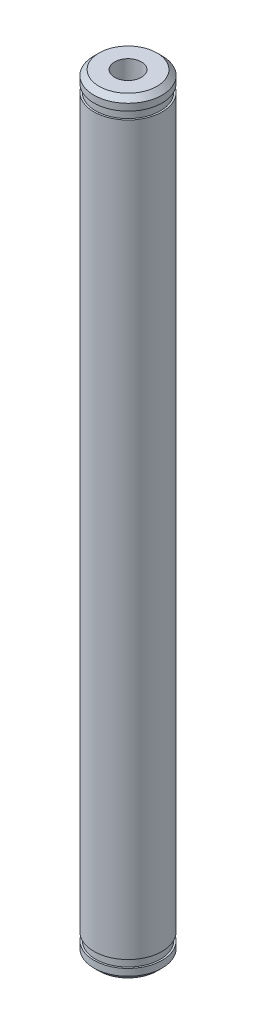
from build123d import *

# Parameters (mm, degrees)
SKETCH1_R                        = 4
BOSS_EXTRUDE1_DEPTH              = 90
CHAMFER1_SIZE                    = 0.6
CUT_EXTRUDE1_START               = -1.4
SKETCH2_R                        = 4
SKETCH2_R_2                      = 3.8
CUT_EXTRUDE1_DEPTH               = 0.9
TAP_DRILL_FOR_M3_HELICOIL1_D     = 3.15
TAP_DRILL_FOR_M3_HELICOIL1_DEPTH = 6


with BuildPart() as part:
    # Sketch1 → Boss-Extrude1 (new body)
    with BuildSketch(Plane(origin=(0, 0, 0), x_dir=(1, 0, 0), z_dir=(0, 1, 0))):
        with Locations(Location((0, 0, 0), (0, 0, 90))):
            Circle(SKETCH1_R)
    extrude(amount=BOSS_EXTRUDE1_DEPTH)

    # Chamfer1
    chamfer1_edges = [part.edges().sort_by_distance(p)[0] for p in [
        (0, 0, 4),
        (0, 90, 4),
    ]]
    chamfer(chamfer1_edges, length=CHAMFER1_SIZE)

    # Sketch2 → Cut-Extrude1 (cut)
    with BuildSketch(Plane.XZ.offset(CUT_EXTRUDE1_START)):
        with Locations(Location((0, 0, 0), (0, 0, 270))):
            Circle(SKETCH2_R)
        with Locations(Location((0, 0, 0), (0, 0, 270))):
            Circle(SKETCH2_R_2, mode=Mode.SUBTRACT)
    cut_extrude1 = extrude(amount=-CUT_EXTRUDE1_DEPTH, mode=Mode.SUBTRACT)

    # Tap Drill for M3 Helicoil1
    with Locations(Plane(origin=(0, 90, 0), x_dir=(1, 0, 0), z_dir=(0, 1, 0))):
        with Locations((0, 0)):
            Hole(TAP_DRILL_FOR_M3_HELICOIL1_D / 2, depth=TAP_DRILL_FOR_M3_HELICOIL1_DEPTH)

    # Mirror1: Cut-Extrude1 across plane
    add(cut_extrude1.mirror(Plane(origin=(0, 45, 0), x_dir=(0, 0, 1), z_dir=(0, -1, 0))), mode=Mode.SUBTRACT)


solid = part.part
